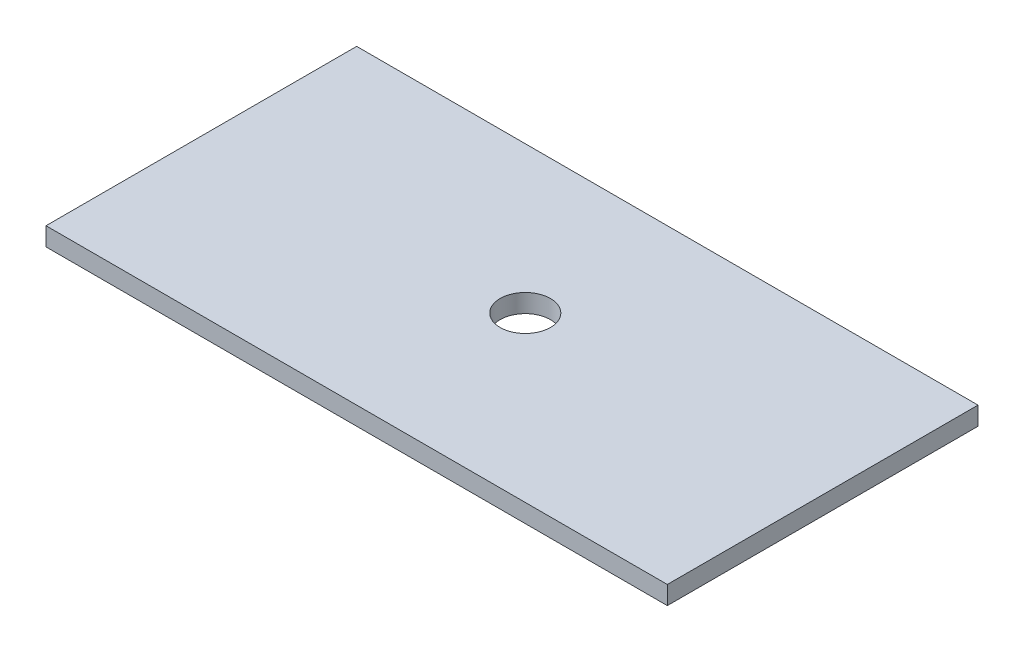
from build123d import *

# Parameters (mm, degrees)
SKETCH_1_W      = 508
SKETCH_1_H      = 254
SKETCH_1_R      = 20.557010216
EXTRUDE_1_DEPTH = 15


with BuildPart() as part:
    # 草图1 → 凸台-拉伸1 (new body)
    with BuildSketch(Plane(origin=(0, 0, 0), x_dir=(1, 0, 0), z_dir=(0, 1, 0))):
        with Locations((254, -127)):
            Rectangle(SKETCH_1_W, SKETCH_1_H)
        with Locations(Location((257.707741618, -119.849355451, 0), (0, 0, 270))):
            Circle(SKETCH_1_R, mode=Mode.SUBTRACT)
    extrude(amount=EXTRUDE_1_DEPTH)


solid = part.part
